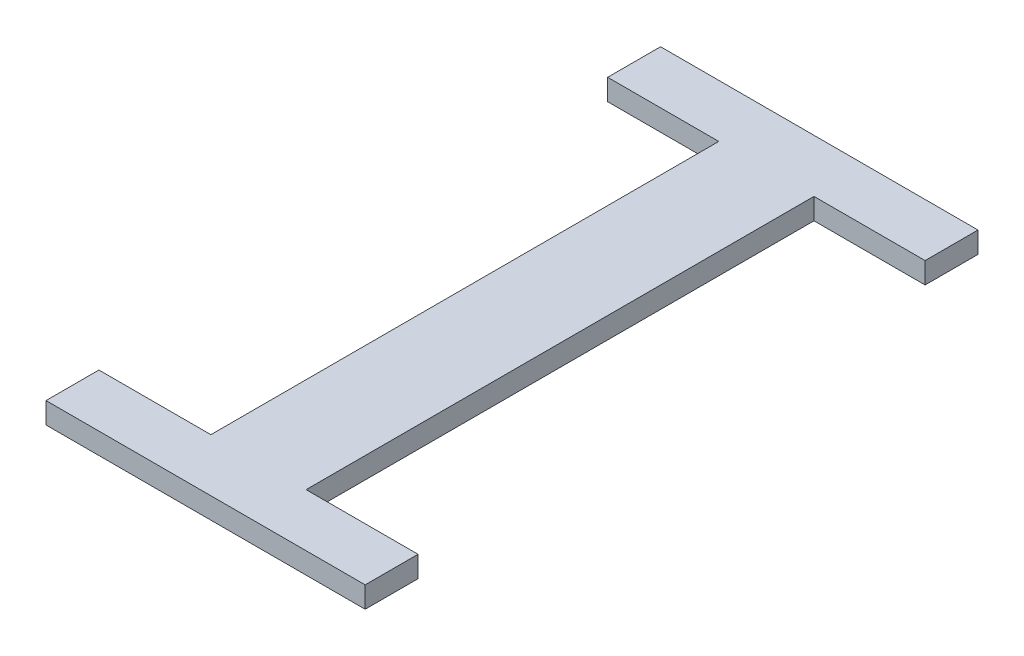
from build123d import *

# Parameters (mm, degrees)
SKETCH1_W           = 310
SKETCH1_H           = 290
BOSS_EXTRUDE1_DEPTH = 10
CUT_EXTRUDE1_DEPTH  = 213.485293609
CUT_EXTRUDE2_DEPTH  = 186.337530006


with BuildPart() as part:
    # Sketch1 → Boss-Extrude1 (new body)
    with BuildSketch(Plane(origin=(0, 0, 0), x_dir=(1, 0, 0), z_dir=(0, 1, 0))):
        Rectangle(SKETCH1_W, SKETCH1_H)
    extrude(amount=BOSS_EXTRUDE1_DEPTH)

    # Sketch2 → Cut-Extrude1 (cut, through all)
    with BuildSketch(Plane(origin=(0, 10, 0), x_dir=(1, 0, 0), z_dir=(0, 1, 0))):
        Polygon((-85.000000124, 145), (-115.000000124, 87.499999968), (-115.000000124, -87.500000032), (-85, -145), (-155, -145), (-155.000000124, 144.999999996), align=None)
        Polygon((155, -145), (155.000000124, 144.999999996), (85.000000124, 145), (115.000000124, 87.499999968), (115.000000124, -87.500000032), (85, -145), align=None)
    extrude(amount=-CUT_EXTRUDE1_DEPTH, mode=Mode.SUBTRACT)

    # Sketch3 → Cut-Extrude2 (cut, through all)
    with BuildSketch(Plane.XZ):
        Polygon((-75.000000124, -145), (-75.000000124, -120), (-22.500000124, -120), (-22.500000124, 120), (-75.407979447, 120), (-75.407979447, 145), (-85, 145), (-115.000000124, 87.500000032), (-115.000000124, -87.499999968), (-85.000000124, -145), align=None)
        Polygon((75.000000124, -120), (22.500000124, -120), (22.500000124, 120), (75.407979447, 120), (75.407979447, 145), (85, 145), (115.000000124, 87.500000032), (115.000000124, -87.499999968), (85.000000124, -145), (75.000000124, -145), align=None)
    extrude(amount=-CUT_EXTRUDE2_DEPTH, mode=Mode.SUBTRACT)


solid = part.part
